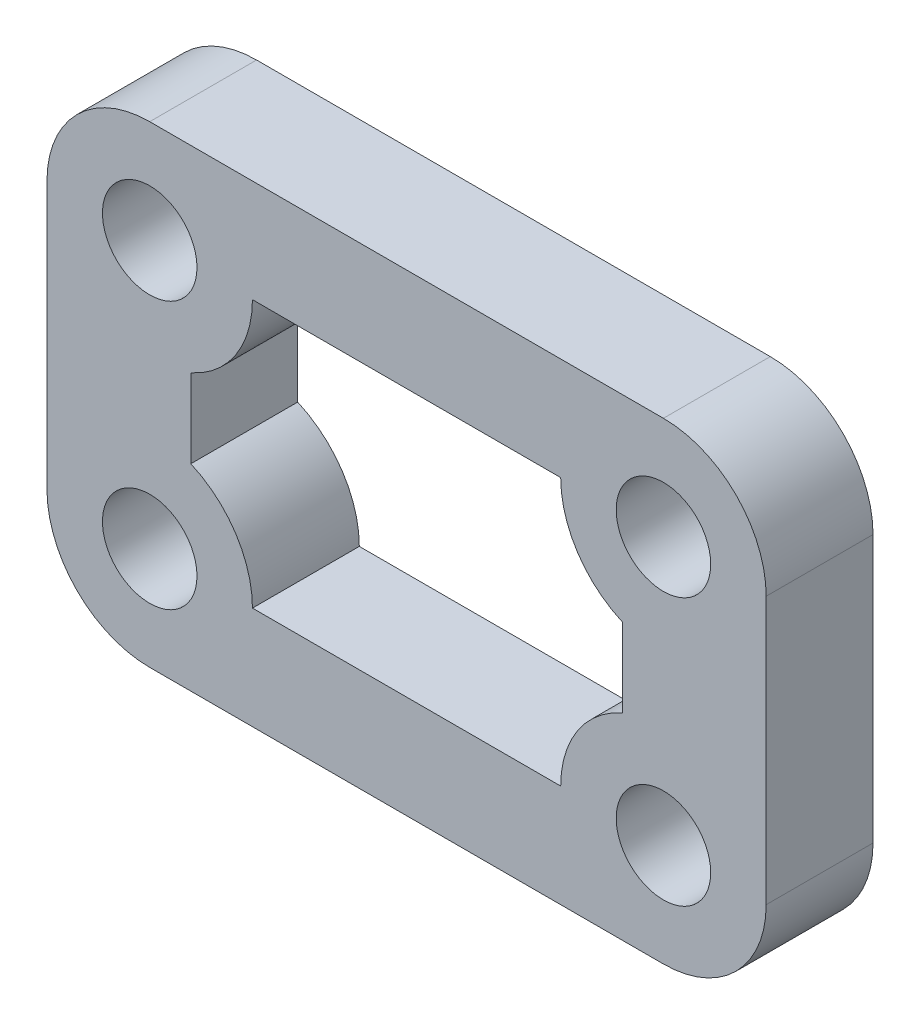
from build123d import *

# Parameters (mm, degrees)
SKETCH_1_R      = 2.3
EXTRUDE_1_DEPTH = 5.2


with BuildPart() as part:
    # 草图1 → 凸台-拉伸1 (new body)
    with BuildSketch(Plane.XY):
        with BuildLine():
            Line((-5, 13), (-5, 0))
            ThreePointArc((-5, 0), (-3.535533906, -3.535533906), (0, -5))
            Line((0, -5), (25, -5))
            ThreePointArc((25, -5), (28.535533906, -3.535533906), (30, 0))
            Line((30, 0), (30, 13))
            ThreePointArc((30, 13), (28.535533906, 16.535533906), (25, 18))
            Line((25, 18), (0, 18))
            ThreePointArc((0, 18), (-3.535533906, 16.535533906), (-5, 13))
        make_face()
        with Locations((0, 13)):
            Circle(SKETCH_1_R, mode=Mode.SUBTRACT)
        with Locations((25, 13)):
            Circle(SKETCH_1_R, mode=Mode.SUBTRACT)
        Circle(SKETCH_1_R, mode=Mode.SUBTRACT)
        with Locations((25, 0)):
            Circle(SKETCH_1_R, mode=Mode.SUBTRACT)
        with BuildLine():
            Line((5, 13), (20, 13))
            ThreePointArc((20, 13), (20.816699867, 10.261387212), (23, 8.417424305))
            Line((23, 8.417424305), (23, 4.582575695))
            ThreePointArc((23, 4.582575695), (20.816699867, 2.738612788), (20, 0))
            Line((20, 0), (5, 0))
            ThreePointArc((5, 0), (4.183300133, 2.738612788), (2, 4.582575695))
            Line((2, 4.582575695), (2, 8.417424305))
            ThreePointArc((2, 8.417424305), (4.183300133, 10.261387212), (5, 13))
        make_face(mode=Mode.SUBTRACT)
    extrude(amount=EXTRUDE_1_DEPTH)


solid = part.part
